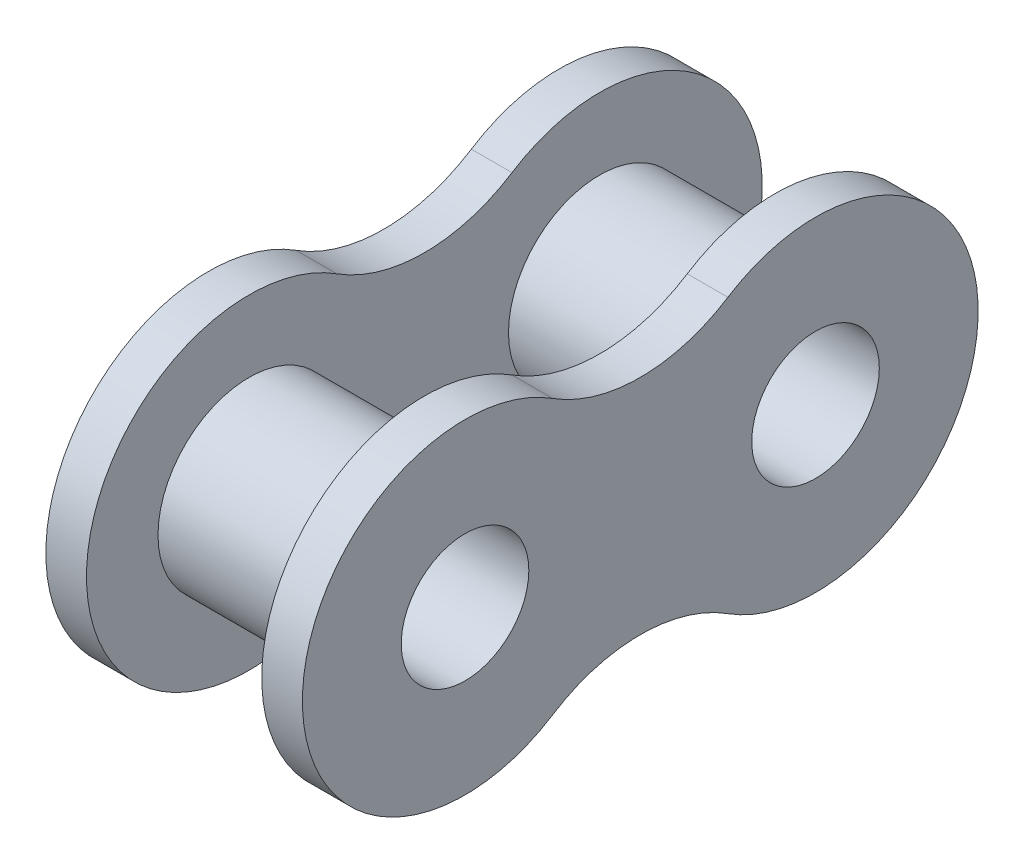
from build123d import *

# Parameters (mm, degrees)
SKETCH1_R           = 1.1557
BOSS_EXTRUDE1_DEPTH = 0.7366
SKETCH2_R           = 1.651
SKETCH2_R_2         = 1.1557
BOSS_EXTRUDE2_DEPTH = 3.175


with BuildPart() as part:
    # Sketch1 → Boss-Extrude1 (new body)
    with BuildSketch(Plane(origin=(0, 0, 0), x_dir=(0, 0, -1), z_dir=(1, 0, 0))):
        with BuildLine():
            ThreePointArc((1.5875, 2.482159687), (-2.9464, 0), (1.5875, -2.482159687))
            ThreePointArc((1.5875, -2.482159687), (3.175, -2.017919373), (4.7625, -2.482159687))
            ThreePointArc((4.7625, -2.482159687), (9.2964, 0), (4.7625, 2.482159687))
            ThreePointArc((4.7625, 2.482159687), (3.175, 2.017919373), (1.5875, 2.482159687))
        make_face()
        Circle(SKETCH1_R, mode=Mode.SUBTRACT)
        with Locations((6.35, 0)):
            Circle(SKETCH1_R, mode=Mode.SUBTRACT)
    boss_extrude1 = extrude(amount=BOSS_EXTRUDE1_DEPTH)

    # Sketch2 → Boss-Extrude2 (add)
    # profile 1 of 2: a face of its own
    with BuildSketch(Plane(origin=(0.7366, 0, 0), x_dir=(0, 0, -1), z_dir=(1, 0, 0))):
        Circle(SKETCH2_R)
        Circle(SKETCH2_R_2, mode=Mode.SUBTRACT)
    # profile 2 of 2: a face of its own
    with BuildSketch(Plane(origin=(0.7366, 0, 0), x_dir=(0, 0, -1), z_dir=(1, 0, 0))):
        with Locations((6.35, 0)):
            Circle(SKETCH2_R)
        with Locations((6.35, 0)):
            Circle(SKETCH2_R_2, mode=Mode.SUBTRACT)
    extrude(amount=BOSS_EXTRUDE2_DEPTH)

    # Mirror1: Boss-Extrude1 across plane
    add(boss_extrude1.mirror(Plane(origin=(2.3241, 0, 0), x_dir=(0, 0, 1), z_dir=(1, 0, 0))))


solid = part.part
